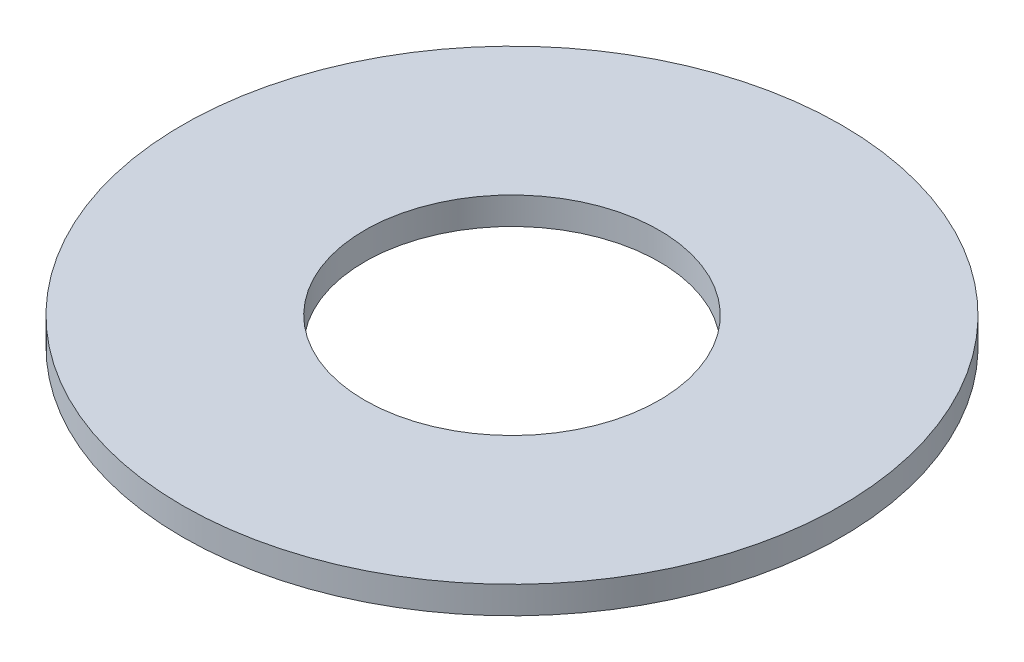
from build123d import *

# Parameters (mm, degrees)
SKETCH1_R           = 24.15
SKETCH1_R_2         = 10.795
BOSS_EXTRUDE1_DEPTH = 2


with BuildPart() as part:
    # Sketch1 → Boss-Extrude1 (new body)
    with BuildSketch(Plane(origin=(0, 0, 0), x_dir=(1, 0, 0), z_dir=(0, 1, 0))):
        with Locations(Location((0, 0, 0), (0, 0, 270))):
            Circle(SKETCH1_R)
        with Locations(Location((0, 0, 0), (0, 0, 270))):
            Circle(SKETCH1_R_2, mode=Mode.SUBTRACT)
    extrude(amount=BOSS_EXTRUDE1_DEPTH)


solid = part.part
